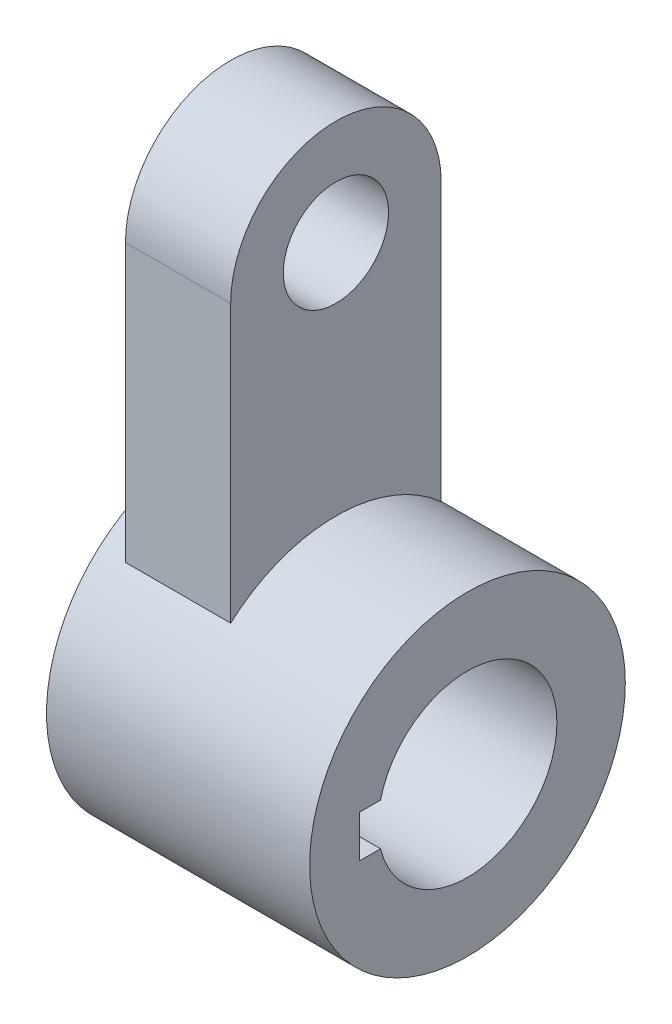
from build123d import *

# Parameters (mm, degrees)
BOSS_EXTRUDE2_DEPTH = 25
SKETCH1_3_R         = 10
BOSS_EXTRUDE3_DEPTH = 20
CUT_EXTRUDE2_DEPTH  = 112.467484048


with BuildPart() as part:
    # Sketch1 → Boss-Extrude2 (new, symmetric)
    with BuildSketch(Plane.YZ):
        with BuildLine():
            ThreePointArc((30, 0), (28.025170769, 10.704662693), (22.360679775, 20))
            ThreePointArc((22.360679775, 20), (-30, 0), (22.360679775, -20))
            ThreePointArc((22.360679775, -20), (28.025170769, -10.704662693), (30, 0))
        make_face()
    extrude(amount=BOSS_EXTRUDE2_DEPTH, both=True)

    # Sketch1<3> → Boss-Extrude3 (add)
    with BuildSketch(Plane.YZ):
        with BuildLine():
            ThreePointArc((75, -20), (95, 0), (75, 20))
            Line((75, 20), (22.360679775, 20))
            ThreePointArc((22.360679775, 20), (28.025170769, 10.704662693), (30, 0))
            ThreePointArc((30, 0), (28.025170769, -10.704662693), (22.360679775, -20))
            Line((22.360679775, -20), (75, -20))
        make_face()
        with Locations((75, 0)):
            Circle(SKETCH1_3_R, mode=Mode.SUBTRACT)
    extrude(amount=-BOSS_EXTRUDE3_DEPTH)

    # Sketch3 → Cut-Extrude2 (cut, through all)
    with BuildSketch(Plane.YZ.offset(25)):
        with BuildLine():
            Line((-4, 20.522711642), (4, 20.522711642))
            Line((4, 20.522711642), (4, 16.522711642))
            ThreePointArc((4, 16.522711642), (0, -17), (-4, 16.522711642))
            Line((-4, 16.522711642), (-4, 20.522711642))
        make_face()
    extrude(amount=-CUT_EXTRUDE2_DEPTH, mode=Mode.SUBTRACT)


solid = part.part
